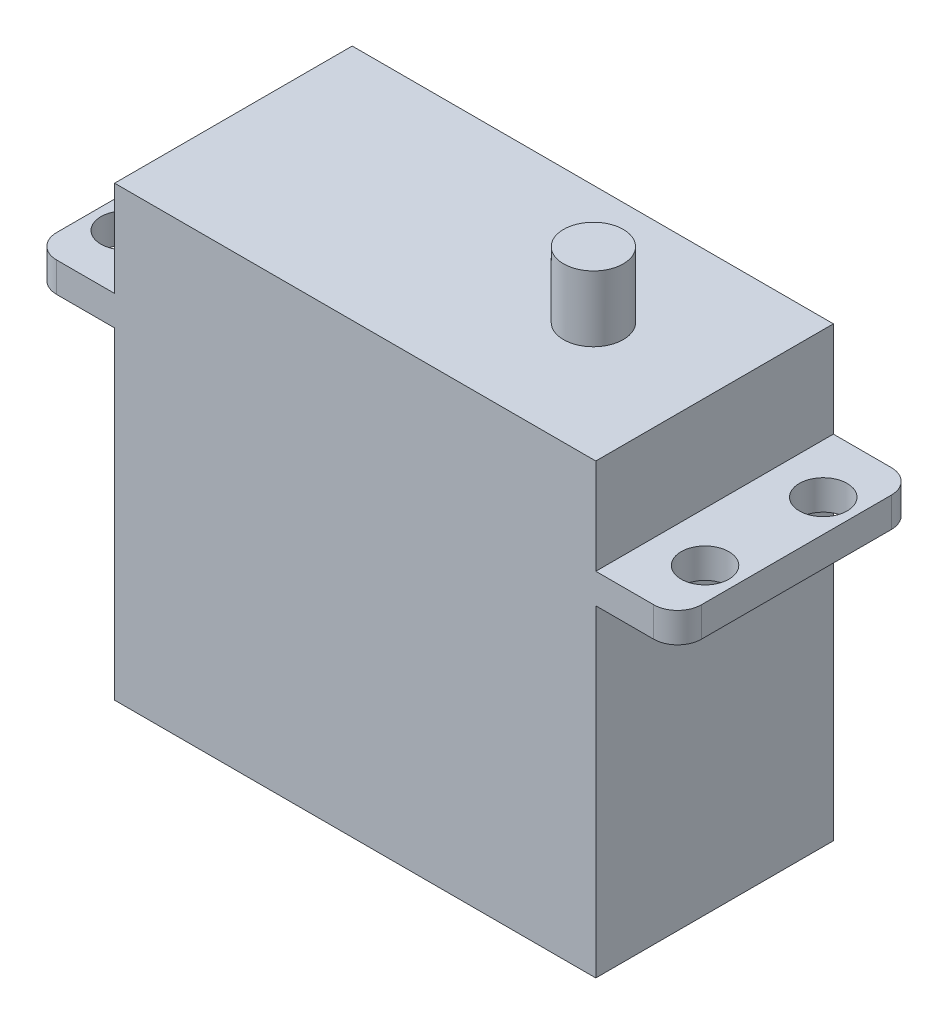
from build123d import *

# Parameters (mm, degrees)
SKETCH_4_W      = 40.3
SKETCH_4_H      = 19.9
EXTRUDE_2_DEPTH = 37.5
EXTRUDE_START   = 27
SKETCH_5_W      = 54
SKETCH_5_H      = 19.9
SKETCH_5_R      = 2
EXTRUDE_3_DEPTH = 2.5
SKETCH_6_R      = 2.5
EXTRUDE_4_DEPTH = 5.5
EXTRUDE_START_2 = 2.37
SKETCH_8_R      = 2.25
EXTRUDE_5_DEPTH = 30.53
FILLET_1_R      = 2


with BuildPart() as part:
    # 草图4 → 凸台-拉伸2 (new body)
    with BuildSketch(Plane(origin=(0, 0, 0), x_dir=(1, 0, 0), z_dir=(0, 1, 0))):
        Rectangle(SKETCH_4_W, SKETCH_4_H)
    extrude(amount=EXTRUDE_2_DEPTH)

    # 草图5 → 凸台-拉伸3 (add)
    with BuildSketch(Plane(origin=(0, 0, 0), x_dir=(1, 0, 0), z_dir=(0, 1, 0)).offset(EXTRUDE_START)):
        Rectangle(SKETCH_5_W, SKETCH_5_H)
        with Locations(Location((24.3, 4.95, 0), (0, 0, 270))):
            Circle(SKETCH_5_R, mode=Mode.SUBTRACT)
        with Locations(Location((24.3, -4.95, 0), (0, 0, 90))):
            Circle(SKETCH_5_R, mode=Mode.SUBTRACT)
        with Locations(Location((-24.3, -4.95, 0), (0, 0, 270))):
            Circle(SKETCH_5_R, mode=Mode.SUBTRACT)
        with Locations(Location((-24.3, 4.95, 0), (0, 0, 90))):
            Circle(SKETCH_5_R, mode=Mode.SUBTRACT)
    extrude(amount=EXTRUDE_3_DEPTH)

    # 草图6 → 凸台-拉伸4 (add)
    with BuildSketch(Plane(origin=(0, 37.5, 0), x_dir=(1, 0, 0), z_dir=(0, 1, 0))):
        with Locations(Location((10, 0, 0), (0, 0, 90))):
            Circle(SKETCH_6_R)
    extrude(amount=EXTRUDE_4_DEPTH)

    # 草图8 → 凸台-拉伸5 (add)
    with BuildSketch(Plane(origin=(0, 32.9, 0), x_dir=(-1, 0, 0), z_dir=(0, -1, 0)).offset(EXTRUDE_START_2)):
        with Locations((-10, 0)):
            Circle(SKETCH_8_R)
    extrude(amount=EXTRUDE_5_DEPTH)

    # 圆角1
    fillet_1_edges = [part.edges().sort_by_distance(p)[0] for p in [
        (27, 28.25, -9.95),
        (-27, 28.25, 9.95),
        (27, 28.25, 9.95),
        (-27, 28.25, -9.95),
    ]]
    fillet(fillet_1_edges, radius=FILLET_1_R)


solid = part.part
